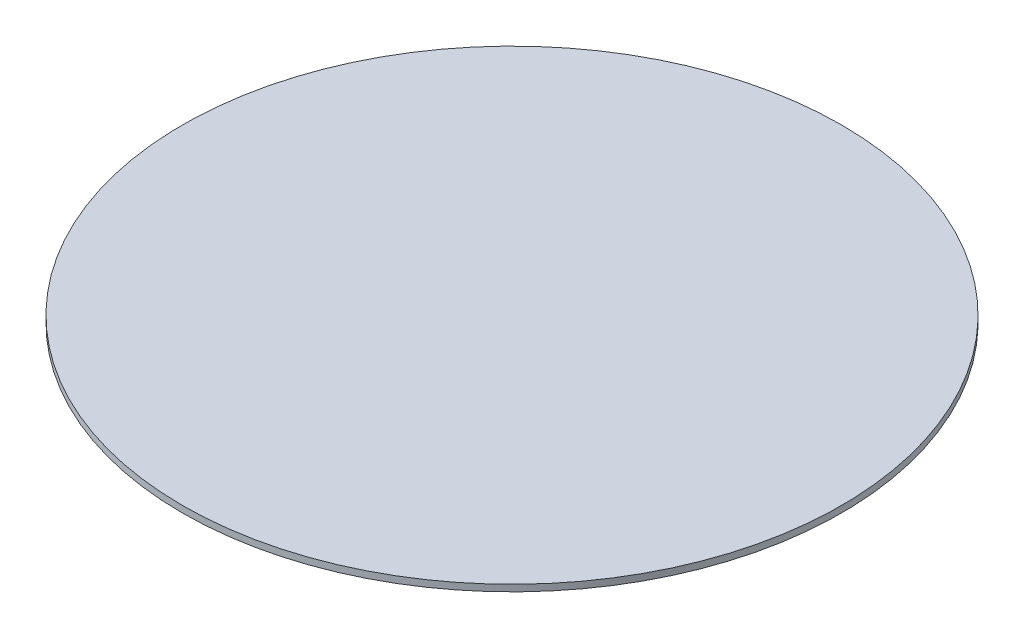
from build123d import *

# Parameters (mm, degrees)
EXTRUDE_2_DEPTH = 48
SKETCH_4_R      = 11
EXTRUDE_3_DEPTH = 2
SKETCH_5_R      = 2.5
EXTRUDE_4_DEPTH = 18
SKETCH_6_R      = 200
EXTRUDE_5_DEPTH = 4


with BuildPart() as part:
    # 草圖3 → 填料-伸長2 (new body)
    with BuildSketch(Plane(origin=(0, 0, 0), x_dir=(1, 0, 0), z_dir=(0, 1, 0))):
        Polygon((-21.15, 0), (-21.15, 15.5), (-15.5, 21.15), (0, 21.15), (15.5, 21.15), (21.15, 15.5), (21.15, 0), (21.15, -15.5), (15.5, -21.15), (0, -21.15), (-15.5, -21.15), (-21.15, -15.5), align=None)
    extrude(amount=EXTRUDE_2_DEPTH)

    # 草圖4 → 填料-伸長3 (add)
    with BuildSketch(Plane(origin=(0, 48, 0), x_dir=(1, 0, 0), z_dir=(0, 1, 0))):
        with Locations(Location((0, 0, 0), (0, 0, 270))):
            Circle(SKETCH_4_R)
    extrude(amount=EXTRUDE_3_DEPTH)

    # 草圖5 → 填料-伸長4 (add)
    with BuildSketch(Plane(origin=(0, 50, 0), x_dir=(1, 0, 0), z_dir=(0, 1, 0))):
        with Locations(Location((0, 0, 0), (0, 0, 270))):
            Circle(SKETCH_5_R)
    extrude(amount=EXTRUDE_4_DEPTH)

    # 草圖6 → 填料-伸長5 (add)
    with BuildSketch(Plane(origin=(0, 68, 0), x_dir=(1, 0, 0), z_dir=(0, 1, 0))):
        with Locations(Location((0, 0, 0), (0, 0, 270))):
            Circle(SKETCH_6_R)
    extrude(amount=EXTRUDE_5_DEPTH)


solid = part.part
